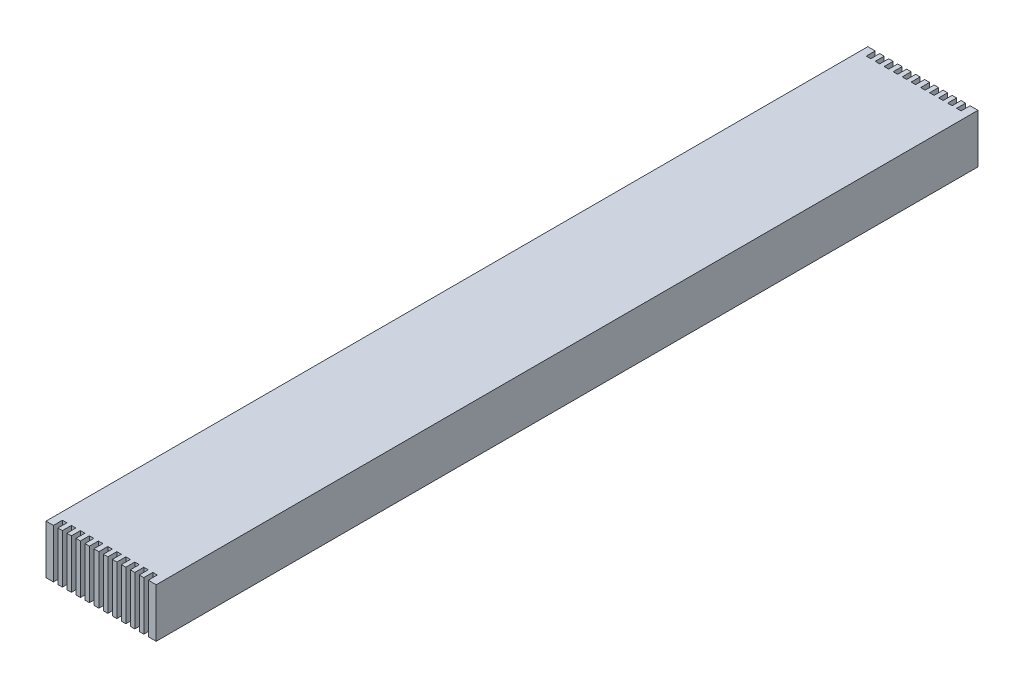
from build123d import *

# Parameters (mm, degrees)
BOSS_EXTRUDE1_DEPTH = 9144
CUT_EXTRUDE1_DEPTH  = 100
CUT_EXTRUDE2_DEPTH  = 100


with BuildPart() as part:
    # Sketch1 → Boss-Extrude1 (new body)
    with BuildSketch(Plane.XY):
        Polygon((390.286155145, -454.00220839), (340.286155145, -454.00220839), (340.286155145, -504.00220839), (290.286155145, -504.00220839), (290.286155145, -454.00220839), (240.286155145, -454.00220839), (240.286155145, -504.00220839), (184.64446635, -504.00220839), (184.64446635, -454.00220839), (134.64446635, -454.00220839), (134.64446635, -504.00220839), (84.64446635, -504.00220839), (84.64446635, -454.00220839), (34.64446635, -454.00220839), (34.64446635, -504.00220839), (-15.35553365, -504.00220839), (-15.35553365, -454.00220839), (-65.35553365, -454.00220839), (-65.35553365, -504.00220839), (-115.35553365, -504.00220839), (-115.35553365, -454.00220839), (-165.35553365, -454.00220839), (-165.35553365, -504.00220839), (-215.35553365, -504.00220839), (-215.35553365, -454.00220839), (-265.35553365, -454.00220839), (-265.35553365, -504.00220839), (-347.890991568, -504.00220839), (-347.890991568, 41.240606266), (878.463301858, 41.240606266), (878.463301858, -504.00220839), (790.286155145, -504.00220839), (790.286155145, -454.00220839), (740.286155145, -454.00220839), (740.286155145, -504.00220839), (690.286155145, -504.00220839), (690.286155145, -454.00220839), (640.286155145, -454.00220839), (640.286155145, -504.00220839), (590.286155145, -504.00220839), (590.286155145, -454.00220839), (540.286155145, -454.00220839), (540.286155145, -504.00220839), (490.286155145, -504.00220839), (490.286155145, -454.00220839), (440.286155145, -454.00220839), (440.286155145, -504.00220839), (390.286155145, -504.00220839), align=None)
    extrude(amount=BOSS_EXTRUDE1_DEPTH)

    # Sketch2 → Cut-Extrude1 (cut)
    with BuildSketch(Plane.XY.offset(9144)):
        Polygon((-265.35553365, -454.00220839), (-265.35553365, 201.707253547), (-265.35553365, 367.434180801), (790.286155145, 367.434180801), (790.286155145, -454.00220839), (740.286155145, -454.00220839), (740.286155145, 201.707253547), (690.286155145, 201.707253547), (690.286155145, -454.00220839), (640.286155145, -454.00220839), (640.286155145, 201.707253547), (590.286155145, 201.707253547), (590.286155145, -454.00220839), (540.286155145, -454.00220839), (540.286155145, 201.707253547), (490.286155145, 201.707253547), (490.286155145, -454.00220839), (440.286155145, -454.00220839), (440.286155145, 201.707253547), (390.286155145, 201.707253547), (390.286155145, -454.00220839), (340.286155145, -454.00220839), (340.286155145, 201.707253547), (290.286155145, 201.707253547), (290.286155145, -454.00220839), (240.286155145, -454.00220839), (240.286155145, 201.707253547), (184.64446635, 201.707253547), (184.64446635, -454.00220839), (134.64446635, -454.00220839), (134.64446635, 201.707253547), (84.64446635, 201.707253547), (84.64446635, -454.00220839), (34.64446635, -454.00220839), (34.64446635, 201.707253547), (-15.35553365, 201.707253547), (-15.35553365, -454.00220839), (-65.35553365, -454.00220839), (-65.35553365, 201.707253547), (-115.35553365, 201.707253547), (-115.35553365, -454.00220839), (-165.35553365, -454.00220839), (-165.35553365, 201.707253547), (-215.35553365, 201.707253547), (-215.35553365, -454.00220839), align=None)
    extrude(amount=-CUT_EXTRUDE1_DEPTH, mode=Mode.SUBTRACT)

    # Sketch3 → Cut-Extrude2 (cut)
    with BuildSketch(Plane(origin=(0, 0, 0), x_dir=(-1, 0, 0), z_dir=(0, 0, -1))):
        Polygon((-790.286155145, -454.00220839), (-790.286155145, 201.707253547), (-790.286155145, 367.434180801), (265.35553365, 367.434180801), (265.35553365, -454.00220839), (215.35553365, -454.00220839), (215.35553365, 201.707253547), (165.35553365, 201.707253547), (165.35553365, -454.00220839), (115.35553365, -454.00220839), (115.35553365, 201.707253547), (65.35553365, 201.707253547), (65.35553365, -454.00220839), (15.35553365, -454.00220839), (15.35553365, 201.707253547), (-34.64446635, 201.707253547), (-34.64446635, -454.00220839), (-84.64446635, -454.00220839), (-84.64446635, 201.707253547), (-134.64446635, 201.707253547), (-134.64446635, -454.00220839), (-184.64446635, -454.00220839), (-184.64446635, 201.707253547), (-234.64446635, 201.707253547), (-234.64446635, -454.00220839), (-284.64446635, -454.00220839), (-284.64446635, 201.707253547), (-340.286155145, 201.707253547), (-340.286155145, -454.00220839), (-390.286155145, -454.00220839), (-390.286155145, 201.707253547), (-440.286155145, 201.707253547), (-440.286155145, -454.00220839), (-490.286155145, -454.00220839), (-490.286155145, 201.707253547), (-540.286155145, 201.707253547), (-540.286155145, -454.00220839), (-590.286155145, -454.00220839), (-590.286155145, 201.707253547), (-640.286155145, 201.707253547), (-640.286155145, -454.00220839), (-690.286155145, -454.00220839), (-690.286155145, 201.707253547), (-740.286155145, 201.707253547), (-740.286155145, -454.00220839), align=None)
    extrude(amount=-CUT_EXTRUDE2_DEPTH, mode=Mode.SUBTRACT)


solid = part.part
